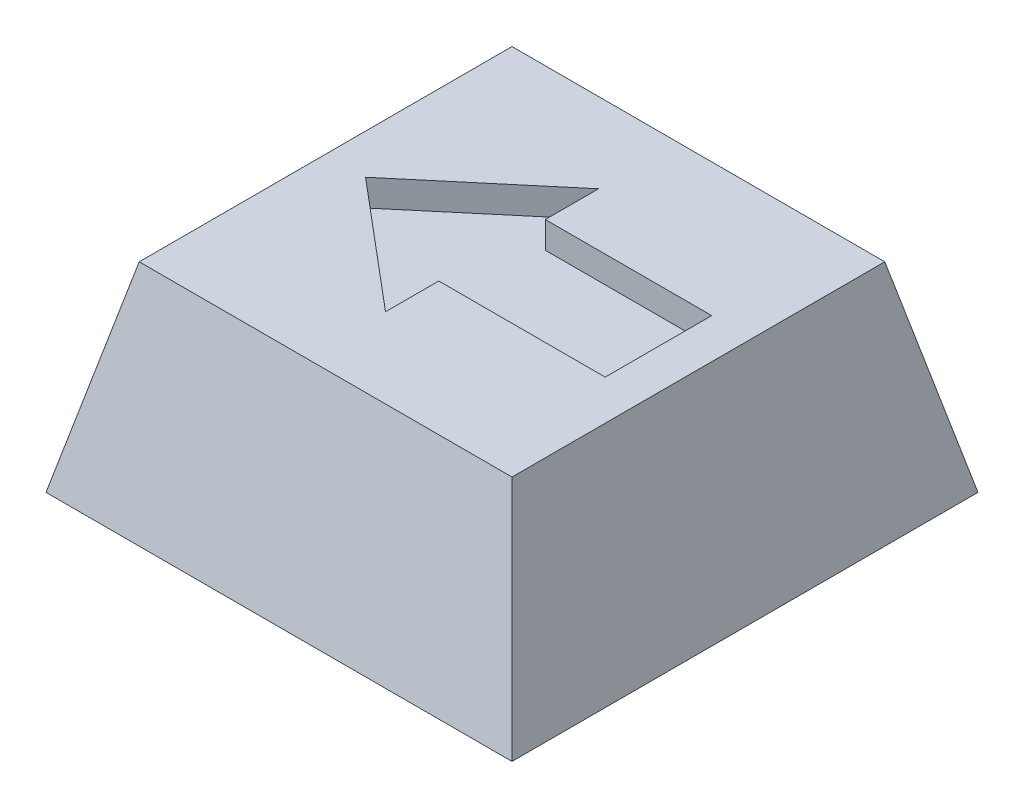
from build123d import *

# Parameters (mm, degrees)
SKETCH1_W           = 7
SKETCH1_H           = 7
BOSS_EXTRUDE1_DEPTH = 3
CUT_EXTRUDE1_DEPTH  = 7
CUT_EXTRUDE2_DEPTH  = 11
SKETCH4_R           = 1.8
CUT_EXTRUDE3_DEPTH  = 0.8
SKETCH5_W           = 2.5
SKETCH5_H           = 1.6
CUT_EXTRUDE4_DEPTH  = 0.4


with BuildPart() as part:
    # Sketch1 → Boss-Extrude1 (new body)
    with BuildSketch(Plane(origin=(0, 0, 0), x_dir=(1, 0, 0), z_dir=(0, 1, 0))):
        with Locations((3.5, 3.5)):
            Rectangle(SKETCH1_W, SKETCH1_H)
    extrude(amount=BOSS_EXTRUDE1_DEPTH)

    # Sketch2 → Cut-Extrude1 (cut)
    with BuildSketch(Plane.XY):
        Polygon((0, 0), (0.7, 3), (0, 3), align=None)
        Polygon((7, 0), (6.3, 3), (7, 3), align=None)
    extrude(amount=-CUT_EXTRUDE1_DEPTH, mode=Mode.SUBTRACT)

    # Sketch3 → Cut-Extrude2 (cut)
    with BuildSketch(Plane(origin=(0, 0, 0), x_dir=(0, 0, -1), z_dir=(1, 0, 0))):
        Polygon((0, 0), (0.7, 3), (0, 3), align=None)
        Polygon((7, 3), (6.3, 3), (7, 0), align=None)
    extrude(amount=CUT_EXTRUDE2_DEPTH, mode=Mode.SUBTRACT)

    # Sketch4 → Cut-Extrude3 (cut)
    with BuildSketch(Plane.XZ):
        with Locations(Location((3.5, -3.5, 0), (0, 0, 270))):
            Circle(SKETCH4_R)
    extrude(amount=-CUT_EXTRUDE3_DEPTH, mode=Mode.SUBTRACT)

    # Sketch5 → Cut-Extrude4 (cut)
    with BuildSketch(Plane(origin=(0, 3, 0), x_dir=(1, 0, 0), z_dir=(0, 1, 0))):
        with Locations((4.45, 3.5)):
            Rectangle(SKETCH5_W, SKETCH5_H)
        Polygon((1.3, 3.5), (3.2, 1.9), (3.2, 2.7), (3.2, 4.3), (3.2, 5.1), align=None)
    extrude(amount=-CUT_EXTRUDE4_DEPTH, mode=Mode.SUBTRACT)


solid = part.part
